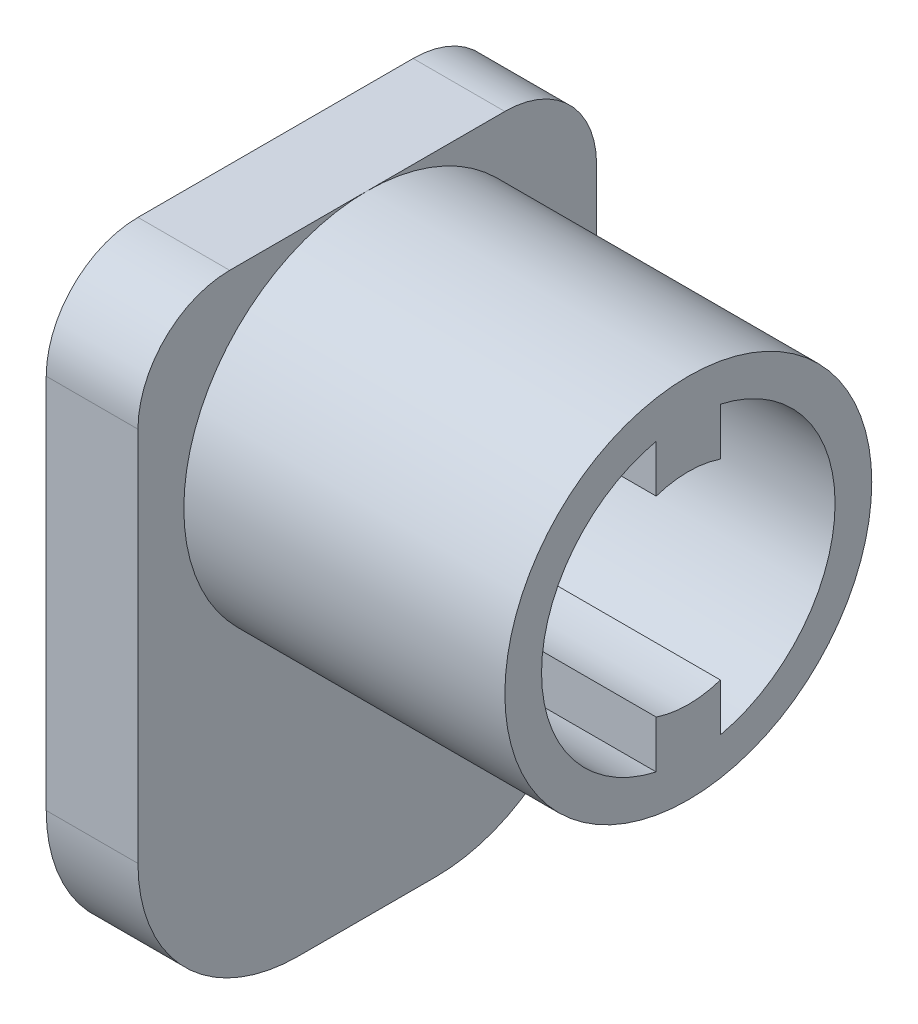
from build123d import *

# Parameters (mm, degrees)
SKETCH2_R           = 4
BOSS_EXTRUDE1_DEPTH = 7
SKETCH3_W           = 10
SKETCH3_H           = 13.7
BOSS_EXTRUDE2_DEPTH = 2
SKETCH4_R           = 3.2
CUT_EXTRUDE1_DEPTH  = 7
SKETCH7_R           = 1.6
CUT_EXTRUDE4_DEPTH  = 15.145317246
BOSS_EXTRUDE3_START = -9
BOSS_EXTRUDE3_DEPTH = 9
FILLET2_R           = 2
FILLET3_R           = 3.5


with BuildPart() as part:
    # Sketch2 → Boss-Extrude1 (new body)
    with BuildSketch(Plane(origin=(0, 0, 0), x_dir=(0, 0, -1), z_dir=(1, 0, 0))):
        Circle(SKETCH2_R)
    extrude(amount=-BOSS_EXTRUDE1_DEPTH)

    # Sketch3 → Boss-Extrude2 (add)
    with BuildSketch(Plane.ZY.offset(7)):
        with Locations((0, -2.85)):
            Rectangle(SKETCH3_W, SKETCH3_H)
    extrude(amount=BOSS_EXTRUDE2_DEPTH)

    # Sketch4 → Cut-Extrude1 (cut)
    with BuildSketch(Plane(origin=(0, 0, 0), x_dir=(0, 0, -1), z_dir=(1, 0, 0))):
        Circle(SKETCH4_R)
    extrude(amount=-CUT_EXTRUDE1_DEPTH, mode=Mode.SUBTRACT)

    # Sketch7 → Cut-Extrude4 (cut, through all)
    with BuildSketch(Plane.ZY.offset(9)):
        Circle(SKETCH7_R)
    extrude(amount=-CUT_EXTRUDE4_DEPTH, mode=Mode.SUBTRACT)

    # Sketch6 → Boss-Extrude3 (add)
    with BuildSketch(Plane.ZY.offset(9).offset(BOSS_EXTRUDE3_START)):
        with BuildLine():
            Line((0.7, -2.861817604), (0.7, -2.085665361))
            ThreePointArc((0.7, -2.085665361), (0, -2.2), (-0.7, -2.085665361))
            Line((-0.7, -2.085665361), (-0.7, -2.861817604))
            Line((-0.7, -2.861817604), (-0.7, -3.122498999))
            ThreePointArc((-0.7, -3.122498999), (0, -3.2), (0.7, -3.122498999))
            Line((0.7, -3.122498999), (0.7, -2.861817604))
        make_face()
        with BuildLine():
            Line((-0.7, 2.085665361), (-0.7, 2.861817604))
            Line((-0.7, 2.861817604), (-0.7, 3.122498999))
            ThreePointArc((-0.7, 3.122498999), (0, 3.2), (0.7, 3.122498999))
            Line((0.7, 3.122498999), (0.7, 2.861817604))
            Line((0.7, 2.861817604), (0.7, 2.085665361))
            ThreePointArc((0.7, 2.085665361), (0, 2.2), (-0.7, 2.085665361))
        make_face()
    extrude(amount=BOSS_EXTRUDE3_DEPTH)

    # Fillet2
    fillet2_edges = [part.edges().sort_by_distance(p)[0] for p in [
        (-8, 4, -5),
        (-8, 4, 5),
    ]]
    fillet(fillet2_edges, radius=FILLET2_R)

    # Fillet3
    fillet3_edges = [part.edges().sort_by_distance(p)[0] for p in [
        (-8, -9.7, -5),
        (-8, -9.7, 5),
    ]]
    fillet(fillet3_edges, radius=FILLET3_R)


solid = part.part
